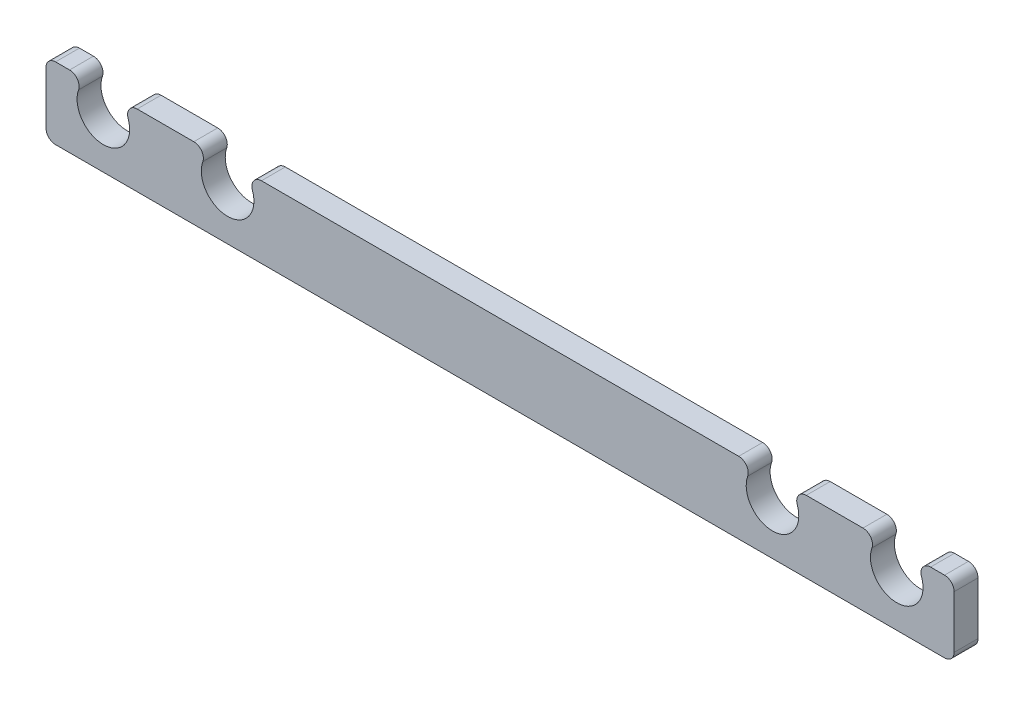
from build123d import *

# Parameters (mm, degrees)
BOSS_EXTRU_1_DEPTH = 5
CONG_1_R           = 2


with BuildPart() as part:
    # Esquisse1 → Boss.-Extru.1 (new body)
    with BuildSketch(Plane.XY):
        with BuildLine():
            Line((-79.83772234, 0), (-60.16227766, 0))
            ThreePointArc((-60.16227766, 0), (-57, -10), (-53.83772234, 0))
            Line((-53.83772234, 0), (53.83772234, 0))
            ThreePointArc((53.83772234, 0), (57, -10), (60.16227766, 0))
            Line((60.16227766, 0), (79.83772234, 0))
            ThreePointArc((79.83772234, 0), (83, -10), (86.16227766, 0))
            Line((86.16227766, 0), (95, 0))
            Line((95, 0), (95, -15))
            Line((95, -15), (-95, -15))
            Line((-95, -15), (-95, 0))
            Line((-95, 0), (-86.16227766, 0))
            ThreePointArc((-86.16227766, 0), (-83, -10), (-79.83772234, 0))
        make_face()
    extrude(amount=BOSS_EXTRU_1_DEPTH)

    # Congé1
    cong_1_edges = [part.edges().sort_by_distance(p)[0] for p in [
        (-86.16227766, 0, 2.5),
        (-79.83772234, 0, 2.5),
        (-60.16227766, 0, 2.5),
        (-53.83772234, 0, 2.5),
        (53.83772234, 0, 2.5),
        (60.16227766, 0, 2.5),
        (79.83772234, 0, 2.5),
        (86.16227766, 0, 2.5),
        (95, 0, 2.5),
        (95, -15, 2.5),
        (-95, -15, 2.5),
        (-95, 0, 2.5),
    ]]
    fillet(cong_1_edges, radius=CONG_1_R)


solid = part.part
